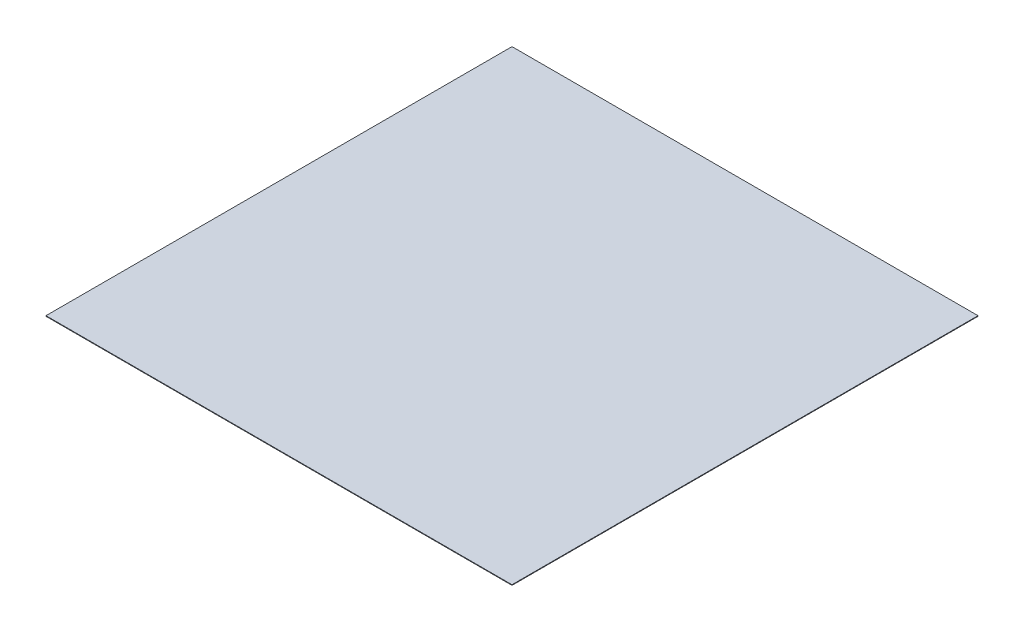
from build123d import *

# Parameters (mm, degrees)
SKETCH_1_W      = 800
SKETCH_1_H      = 800
EXTRUDE_1_DEPTH = 1


with BuildPart() as part:
    # 草图1 → 凸台-拉伸1 (new body)
    with BuildSketch(Plane(origin=(0, 0, 0), x_dir=(1, 0, 0), z_dir=(0, 1, 0))):
        Rectangle(SKETCH_1_W, SKETCH_1_H)
    extrude(amount=EXTRUDE_1_DEPTH)


solid = part.part
